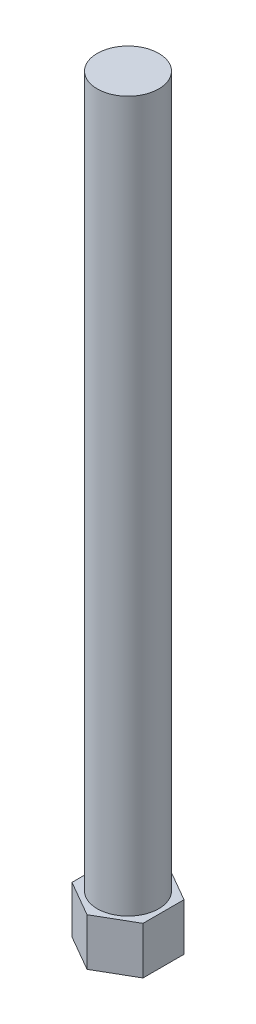
from build123d import *

# Parameters (mm, degrees)
BOSS_EXTRUDE1_DEPTH = 0.2
SKETCH2_R           = 0.13
BOSS_EXTRUDE2_DEPTH = 3


with BuildPart() as part:
    # Sketch1 → Boss-Extrude1 (new body)
    with BuildSketch(Plane(origin=(0, 0, 0), x_dir=(1, 0, 0), z_dir=(0, 1, 0))):
        Polygon((0.15, -0.08660254), (0.15, 0.08660254), (0, 0.173205081), (-0.15, 0.08660254), (-0.15, -0.08660254), (0, -0.173205081), align=None)
    extrude(amount=BOSS_EXTRUDE1_DEPTH)

    # Sketch2 → Boss-Extrude2 (add)
    with BuildSketch(Plane(origin=(0, 0.2, 0), x_dir=(1, 0, 0), z_dir=(0, 1, 0))):
        with Locations(Location((0, 0, 0), (0, 0, 270))):
            Circle(SKETCH2_R)
    extrude(amount=BOSS_EXTRUDE2_DEPTH)


solid = part.part
